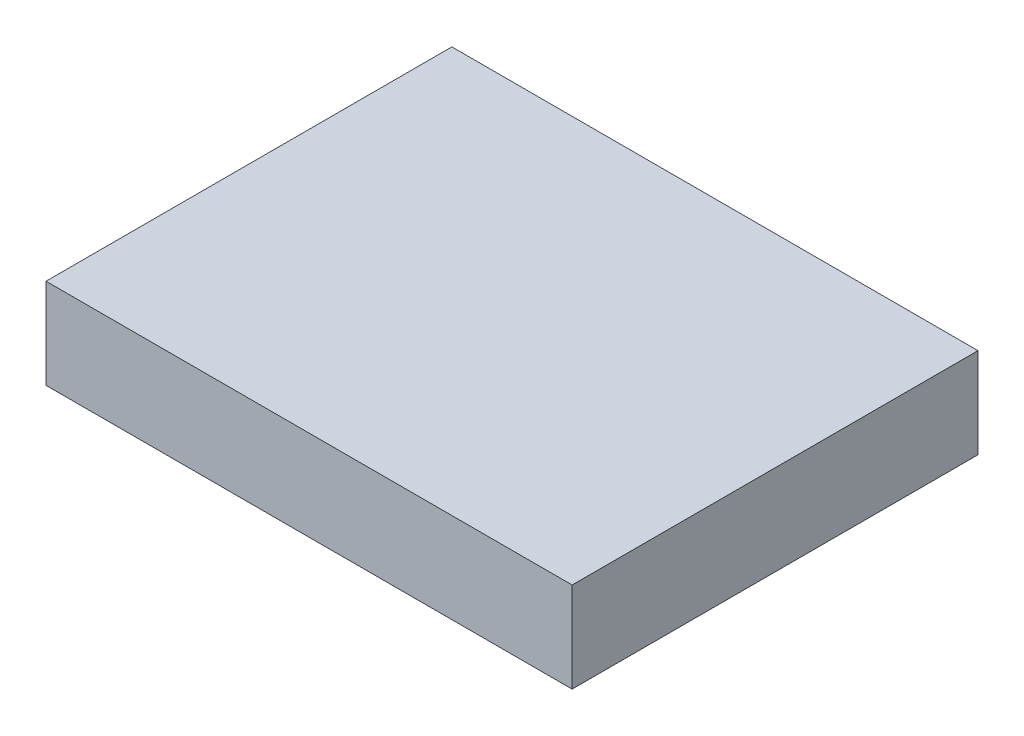
from build123d import *

# Parameters (mm, degrees)
SKETCH_1_W      = 70
SKETCH_1_H      = 54
EXTRUDE_1_DEPTH = 12


with BuildPart() as part:
    # 草图1 → 凸台-拉伸1 (new body)
    with BuildSketch(Plane(origin=(0, 0, 0), x_dir=(1, 0, 0), z_dir=(0, 1, 0))):
        Rectangle(SKETCH_1_W, SKETCH_1_H)
    extrude(amount=EXTRUDE_1_DEPTH)


solid = part.part
